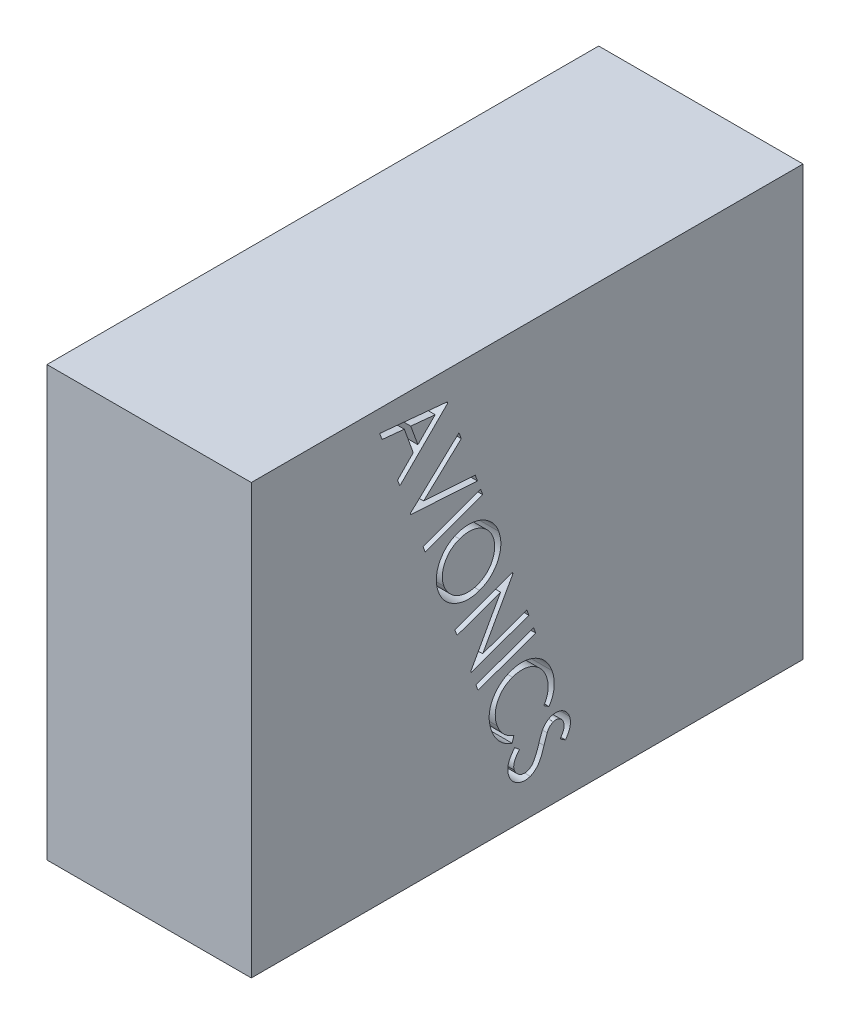
from build123d import *

# Parameters (mm, degrees)
SKETCH1_W           = 25.4
SKETCH1_H           = 68.58
BOSS_EXTRUDE1_DEPTH = 53.34
CUT_EXTRUDE1_DEPTH  = 12.7


with BuildPart() as part:
    # Sketch1 → Boss-Extrude1 (new body)
    with BuildSketch(Plane(origin=(0, 0, 0), x_dir=(1, 0, 0), z_dir=(0, 1, 0))):
        with Locations((12.7, -34.29)):
            Rectangle(SKETCH1_W, SKETCH1_H)
    extrude(amount=BOSS_EXTRUDE1_DEPTH)

    # Sketch2 → Cut-Extrude1 (cut)
    # profile 1 of 8: a face of its own
    with BuildSketch(Plane(origin=(25.4, 0, 0), x_dir=(0, 0, -1), z_dir=(1, 0, 0))):
        Polygon((-44.16917092, 49.671424019), (-50.119243036, 43.742722096), (-50.397055536, 44.512049019), (-48.447788709, 46.487265366), (-49.565144478, 49.572205269), (-52.32495217, 49.839332673), (-52.614976209, 50.637662), (-44.231755055, 49.845438442), align=None)
        Polygon((-45.720036305, 49.208912), (-48.75918294, 49.501988923), (-47.872319959, 47.053575462), align=None, mode=Mode.SUBTRACT)
    # profile 2 of 8: a face of its own
    with BuildSketch(Plane(origin=(25.4, 0, 0), x_dir=(0, 0, -1), z_dir=(1, 0, 0))):
        Polygon((-42.766043114, 45.790495402), (-42.483651287, 45.012009825), (-47.157617633, 40.640279055), (-40.75266571, 40.229666075), (-40.470273883, 39.451180498), (-48.755802729, 39.974750209), (-48.812281094, 40.130447325), align=None)
    # profile 3 of 8: a face of its own
    with BuildSketch(Plane(origin=(25.4, 0, 0), x_dir=(0, 0, -1), z_dir=(1, 0, 0))):
        Polygon((-40.079346336, 38.366271869), (-39.819851144, 37.651896869), (-46.977339125, 35.061524272), (-47.236834317, 35.775899272), align=None)
    # profile 4 of 8: a face of its own
    with BuildSketch(Plane(origin=(25.4, 0, 0), x_dir=(0, 0, -1), z_dir=(1, 0, 0))):
        with BuildLine():
            add(Edge.make_bspline(
                [(-37.829882754, 32.714863476), (-37.785267167, 32.580724937), (-37.697538369, 32.316964814), (-37.608763569, 31.915252951), (-37.561123176, 31.518007358), (-37.55242409, 31.124608635), (-37.58733616, 30.735568172), (-37.658403194, 30.350062921), (-37.772991137, 29.969957756), (-37.924818405, 29.598624354), (-38.110002692, 29.243614543), (-38.323122902, 28.911805727), (-38.568114338, 28.611093099), (-38.839561192, 28.338001257), (-39.138588589, 28.091964945), (-39.467218294, 27.877009137), (-39.822870145, 27.688109165), (-40.076186734, 27.590081998), (-40.205026985, 27.540224052)],
                knots=[0, 0, 0, 0, 1.067200589, 2.098464488, 3.10092662, 4.084942768, 5.064739798, 6.046118302, 7.040726449, 8.057691432, 9.071856908, 10.061074992, 11.031001726, 11.995706702, 12.965085102, 13.949971397, 14.957327668, 16, 16, 16, 16], degree=3))
            add(Edge.make_bspline(
                [(-40.205026985, 27.540224052), (-40.335093963, 27.497115516), (-40.591217345, 27.41222768), (-40.982366944, 27.327958075), (-41.370553718, 27.285546127), (-41.756272646, 27.279470221), (-42.139712091, 27.317761712), (-42.520925823, 27.391996525), (-42.898995188, 27.508211758), (-43.269648466, 27.661629242), (-43.625617833, 27.846759145), (-43.956021023, 28.063651435), (-44.258417921, 28.306790188), (-44.531070294, 28.578402419), (-44.775871881, 28.876847914), (-44.990908184, 29.202719403), (-45.178059724, 29.556458023), (-45.276255075, 29.807447233), (-45.326240927, 29.935212033)],
                knots=[0, 0, 0, 0, 1.044064595, 2.055935797, 3.043295084, 4.016974325, 4.991163374, 5.975538993, 6.973116273, 8.001038217, 9.029896524, 10.027209824, 11.009198109, 11.982900529, 12.955860951, 13.946696156, 14.954775961, 16, 16, 16, 16], degree=3))
            add(Edge.make_bspline(
                [(-45.326240927, 29.935212033), (-45.369906317, 30.066287097), (-45.456052335, 30.324880802), (-45.54114773, 30.719662691), (-45.586270676, 31.111362042), (-45.59031114, 31.499483506), (-45.557784786, 31.884910503), (-45.481044187, 32.266482352), (-45.368312915, 32.645863031), (-45.214045642, 33.015956312), (-45.029524666, 33.371442386), (-44.816155994, 33.702748209), (-44.572791888, 34.003306949), (-44.305489781, 34.276517743), (-44.010121805, 34.519557647), (-43.687340168, 34.731245714), (-43.340204883, 34.919236283), (-43.092205105, 35.015307967), (-42.966361119, 35.064058187)],
                knots=[0, 0, 0, 0, 1.054117405, 2.079633748, 3.076545789, 4.059373172, 5.038100599, 6.023871227, 7.025456738, 8.054835403, 9.079910253, 10.079769352, 11.057687069, 12.027307119, 12.993177383, 13.971411352, 14.970621335, 16, 16, 16, 16], degree=3))
            add(Edge.make_bspline(
                [(-42.966361119, 35.064058187), (-42.88071638, 35.093169872), (-42.710449814, 35.151045542), (-42.450638815, 35.217376557), (-42.190248228, 35.268262085), (-41.928739556, 35.302185524), (-41.666025054, 35.31767948), (-41.402492569, 35.313428579), (-41.138222606, 35.296418077), (-40.874920937, 35.25856626), (-40.614543722, 35.207978885), (-40.360823788, 35.13865117), (-40.114531537, 35.054664955), (-39.875506893, 34.955493097), (-39.645083069, 34.839387187), (-39.422804937, 34.706929643), (-39.207549744, 34.560965037), (-39.001644034, 34.399104562), (-38.807469216, 34.224116155), (-38.624728935, 34.039206602), (-38.457160682, 33.843326739), (-38.301769587, 33.638805812), (-38.16315491, 33.422006061), (-38.036190694, 33.196763372), (-37.923811972, 32.960624422), (-37.861363793, 32.797231987), (-37.829882754, 32.714863476)],
                knots=[0, 0, 0, 0, 1.036257293, 2.060137867, 3.069858606, 4.075125121, 5.079698108, 6.082645353, 7.093779231, 8.112149705, 9.12871586, 10.131544458, 11.123551062, 12.108938427, 13.094601763, 14.07757108, 15.072161775, 16.072954239, 17.07625734, 18.065793361, 19.049851535, 20.028244846, 21.006725023, 21.996106427, 22.989807995, 24, 24, 24, 24], degree=3))
        make_face()
        with BuildLine():
            add(Edge.make_bspline(
                [(-38.518308235, 32.427892322), (-38.543346222, 32.492902124), (-38.593341859, 32.62271314), (-38.684370625, 32.809767901), (-38.784489431, 32.991375905), (-38.899919749, 33.163195725), (-39.025370396, 33.329674321), (-39.164474759, 33.487471378), (-39.314265737, 33.639484146), (-39.475957104, 33.782070144), (-39.645210831, 33.915771763), (-39.821629888, 34.036297043), (-40.002144669, 34.146136696), (-40.189837533, 34.240169366), (-40.382822638, 34.32113489), (-40.580558454, 34.390161139), (-40.783824766, 34.447042743), (-40.992038286, 34.48923246), (-41.20310525, 34.518273116), (-41.415215792, 34.534038647), (-41.628412692, 34.533505918), (-41.842005807, 34.519735569), (-42.056338367, 34.492665561), (-42.270236383, 34.449098094), (-42.484973759, 34.392938325), (-42.62623273, 34.344957987), (-42.697707273, 34.320680783)],
                knots=[0, 0, 0, 0, 0.982677163, 1.962201343, 2.93300202, 3.906825105, 4.88048935, 5.872747212, 6.87297473, 7.890247217, 8.912978623, 9.914777024, 10.903599657, 11.892630825, 12.874126806, 13.855123639, 14.846367786, 15.850402376, 16.850629893, 17.851269684, 18.84932997, 19.85664556, 20.870160701, 21.895308964, 22.935063525, 24, 24, 24, 24], degree=3))
            add(Edge.make_bspline(
                [(-42.697707273, 34.320680783), (-42.800804344, 34.280342552), (-43.003993007, 34.200842027), (-43.290760379, 34.050379827), (-43.553999297, 33.875041033), (-43.797503157, 33.679546621), (-44.016311159, 33.458235894), (-44.212824545, 33.214318136), (-44.385544276, 32.946724097), (-44.535492886, 32.660692263), (-44.658001906, 32.362055457), (-44.752413007, 32.058865341), (-44.813866132, 31.753505715), (-44.843281765, 31.446558557), (-44.839584946, 31.138151821), (-44.806088892, 30.828770582), (-44.740200113, 30.517854502), (-44.67333172, 30.314742053), (-44.639341889, 30.211498091)],
                knots=[0, 0, 0, 0, 1.049760222, 2.068917917, 3.065030173, 4.046626013, 5.026285143, 6.011636567, 7.013173136, 8.04312309, 9.071352081, 10.071491644, 11.05134105, 12.021150506, 12.991488442, 13.972371827, 14.969337595, 16, 16, 16, 16], degree=3))
            add(Edge.make_bspline(
                [(-44.639341889, 30.211498091), (-44.613377207, 30.143394831), (-44.561697953, 30.007844328), (-44.466847563, 29.813308195), (-44.366110739, 29.623866627), (-44.248878096, 29.446385922), (-44.123572474, 29.275320191), (-43.986149461, 29.113809761), (-43.837295562, 28.96085496), (-43.679228689, 28.816055595), (-43.512144315, 28.682196589), (-43.338025693, 28.561635312), (-43.158445498, 28.454179227), (-42.973316875, 28.359412256), (-42.782384511, 28.276554442), (-42.584939101, 28.207671784), (-42.381659497, 28.153316609), (-42.173839334, 28.110164279), (-41.963230405, 28.081021051), (-41.751010915, 28.068157452), (-41.538436532, 28.065709152), (-41.325127549, 28.079360088), (-41.111848199, 28.109724168), (-40.897884744, 28.149960831), (-40.683821595, 28.206695376), (-40.54312054, 28.254772972), (-40.472154389, 28.279022129)],
                knots=[0, 0, 0, 0, 1.023872924, 2.037883193, 3.039537076, 4.037277385, 5.024194777, 6.018623438, 7.014927485, 8.022258237, 9.029665142, 10.021544807, 10.996575592, 11.968875045, 12.942646167, 13.919694268, 14.905055825, 15.898043433, 16.90132984, 17.890317871, 18.884386465, 19.887647383, 20.890933789, 21.910577212, 22.946146528, 24, 24, 24, 24], degree=3))
            add(Edge.make_bspline(
                [(-40.472154389, 28.279022129), (-40.402594853, 28.30562651), (-40.264772703, 28.358339238), (-40.066045919, 28.452036063), (-39.876890286, 28.556246822), (-39.695544989, 28.668422761), (-39.52667821, 28.79429326), (-39.366272243, 28.929561989), (-39.21593563, 29.07554882), (-39.075201183, 29.231583318), (-38.945405087, 29.396134211), (-38.827919385, 29.569527666), (-38.720659768, 29.748847655), (-38.627730693, 29.935989252), (-38.546234214, 30.12906361), (-38.477582861, 30.32954349), (-38.421207549, 30.537116403), (-38.377543456, 30.750282033), (-38.34470396, 30.965201026), (-38.328932957, 31.180504251), (-38.32311217, 31.393569998), (-38.334362921, 31.604721843), (-38.35905858, 31.813716969), (-38.396561854, 32.021032726), (-38.450623697, 32.226203171), (-38.495677486, 32.360456292), (-38.518308235, 32.427892322)],
                knots=[0, 0, 0, 0, 1.05060848, 2.081628613, 3.097005521, 4.0970358, 5.087874072, 6.066014638, 7.056124275, 8.042347484, 9.029119371, 10.010889608, 10.995962214, 11.975287847, 12.956716732, 13.951216084, 14.963160293, 15.989670693, 17.02029076, 18.028560541, 19.03396315, 20.026049264, 21.00923616, 22.002049458, 22.996419216, 24, 24, 24, 24], degree=3))
        make_face(mode=Mode.SUBTRACT)
    # profile 5 of 8: a face of its own
    with BuildSketch(Plane(origin=(25.4, 0, 0), x_dir=(0, 0, -1), z_dir=(1, 0, 0))):
        Polygon((-43.274546824, 24.829265138), (-36.117058843, 27.419637734), (-36.060580478, 27.263940619), (-39.817154997, 20.523171388), (-34.338753555, 22.506019946), (-34.083837689, 21.8008036), (-41.24132567, 19.210431004), (-41.299330478, 19.370707446), (-37.596181439, 26.048892542), (-43.00741942, 24.090467061), align=None)
    # profile 6 of 8: a face of its own
    with BuildSketch(Plane(origin=(25.4, 0, 0), x_dir=(0, 0, -1), z_dir=(1, 0, 0))):
        Polygon((-33.497356517, 20.177483155), (-33.237861325, 19.463108155), (-40.395349305, 16.872735559), (-40.654844498, 17.587110559), align=None)
    # profile 7 of 8: a face of its own
    with BuildSketch(Plane(origin=(25.4, 0, 0), x_dir=(0, 0, -1), z_dir=(1, 0, 0))):
        with BuildLine():
            Line((-31.577604473, 10.725233416), (-32.215657358, 11.132793512))
            add(Edge.make_bspline(
                [(-32.215657358, 11.132793512), (-32.180392559, 11.1899031), (-32.110319064, 11.303383643), (-32.017547123, 11.479492825), (-31.934928876, 11.657586422), (-31.864166895, 11.838438067), (-31.80634467, 12.022224769), (-31.759222387, 12.208280749), (-31.721798365, 12.396679195), (-31.6901104, 12.651581065), (-31.67484719, 12.974069313), (-31.705269062, 13.363767805), (-31.779231151, 13.755363539), (-31.863181307, 14.010428552), (-31.905789569, 14.139884858)],
                knots=[0, 0, 0, 0, 0.770156689, 1.530352452, 2.282860732, 3.022455832, 3.75751832, 4.492604005, 5.224435024, 5.960355296, 7.439199635, 8.920808603, 10.437179852, 12, 12, 12, 12], degree=3))
            add(Edge.make_bspline(
                [(-31.905789569, 14.139884858), (-31.932356927, 14.209966451), (-31.985234959, 14.349452534), (-32.080226072, 14.550903965), (-32.18775124, 14.743568886), (-32.305013397, 14.928416514), (-32.433504058, 15.104746457), (-32.574254102, 15.27158968), (-32.72769571, 15.428688417), (-32.890182927, 15.577588764), (-33.06036674, 15.716526496), (-33.237626481, 15.841521611), (-33.419507087, 15.953481084), (-33.606920643, 16.051325222), (-33.798558129, 16.137556655), (-33.996653138, 16.206984865), (-34.198678595, 16.265998384), (-34.405918684, 16.3095871), (-34.615908131, 16.340589333), (-34.827142903, 16.355426329), (-35.038721665, 16.356979225), (-35.251428016, 16.345009817), (-35.465670909, 16.317393872), (-35.680567665, 16.273967355), (-35.8967108, 16.218452978), (-36.038187671, 16.169046343), (-36.109611685, 16.144103608)],
                knots=[0, 0, 0, 0, 1.038340507, 2.066648967, 3.082993726, 4.094287257, 5.09845153, 6.104198958, 7.116450724, 8.139548353, 9.157090926, 10.158751694, 11.143138996, 12.114561561, 13.086802683, 14.052501663, 15.02105383, 16.00156971, 16.984794658, 17.960405069, 18.933489607, 19.915221695, 20.910508737, 21.924134845, 22.952008063, 24, 24, 24, 24], degree=3))
            add(Edge.make_bspline(
                [(-36.109611685, 16.144103608), (-36.215286936, 16.102816429), (-36.423198055, 16.021585833), (-36.716285832, 15.867564051), (-36.98532458, 15.690159823), (-37.23218592, 15.491101684), (-37.452624391, 15.266315336), (-37.651019782, 15.019126868), (-37.824908765, 14.748211783), (-37.973391386, 14.457546194), (-38.095845212, 14.154071133), (-38.184718609, 13.841891787), (-38.239406368, 13.524591937), (-38.264673082, 13.203085543), (-38.255164111, 12.87613896), (-38.210868116, 12.54475733), (-38.137225731, 12.208141), (-38.063005144, 11.986997963), (-38.025296781, 11.874644474)],
                knots=[0, 0, 0, 0, 1.040053598, 2.046256863, 3.030032179, 3.992181451, 4.949246196, 5.912097015, 6.894687067, 7.896594933, 8.901921086, 9.891744485, 10.867739637, 11.85067323, 12.845161879, 13.861692185, 14.913615597, 16, 16, 16, 16], degree=3))
            add(Edge.make_bspline(
                [(-38.025296781, 11.874644474), (-37.977652593, 11.752817147), (-37.883848366, 11.512957493), (-37.697915137, 11.179020271), (-37.483295413, 10.872370916), (-37.236705031, 10.594901718), (-36.957525026, 10.347042955), (-36.647056609, 10.129036748), (-36.307264167, 9.935006339), (-36.062068131, 9.835599599), (-35.937123704, 9.784944954)],
                knots=[0, 0, 0, 0, 1.027142456, 2.022288772, 2.995309205, 3.964055138, 4.932801071, 5.922541067, 6.941390241, 8, 8, 8, 8], degree=3))
            Line((-35.937123704, 9.784944954), (-36.161510723, 9.065990627))
            add(Edge.make_bspline(
                [(-36.161510723, 9.065990627), (-36.233608314, 9.091018013), (-36.37743053, 9.140943315), (-36.585890261, 9.231942255), (-36.789052558, 9.332320093), (-36.983846125, 9.447679949), (-37.173221907, 9.572488388), (-37.35633098, 9.708862133), (-37.530990135, 9.859053391), (-37.700666325, 10.018501075), (-37.861079516, 10.189947242), (-38.012348254, 10.371965305), (-38.154396763, 10.563893274), (-38.285144895, 10.766752157), (-38.410470042, 10.977274206), (-38.521971249, 11.200561269), (-38.626671329, 11.432504714), (-38.687564279, 11.592428417), (-38.718301588, 11.673154089)],
                knots=[0, 0, 0, 0, 0.967901867, 1.930796716, 2.883467384, 3.841133256, 4.800776904, 5.760029666, 6.735372506, 7.721697631, 8.712722229, 9.711975061, 10.722898728, 11.739884189, 12.772826926, 13.829441077, 14.904353615, 16, 16, 16, 16], degree=3))
            add(Edge.make_bspline(
                [(-38.718301588, 11.673154089), (-38.745428574, 11.750778712), (-38.798958159, 11.903955105), (-38.866621016, 12.134525525), (-38.918930702, 12.36331788), (-38.964734213, 12.588376708), (-38.994858222, 12.811767768), (-39.012812102, 13.032389229), (-39.021697933, 13.250454426), (-39.014434421, 13.465989811), (-38.998387172, 13.67855507), (-38.969235097, 13.888062302), (-38.927719308, 14.094931052), (-38.874639551, 14.299461973), (-38.807894562, 14.501240618), (-38.732965191, 14.701505747), (-38.641605633, 14.897324815), (-38.573847304, 15.025002595), (-38.539707838, 15.089331974)],
                knots=[0, 0, 0, 0, 1.116479952, 2.203145904, 3.260624569, 4.302619282, 5.320770913, 6.319132338, 7.307739823, 8.282317243, 9.245687013, 10.20129557, 11.152498069, 12.10937959, 13.068553165, 14.037333571, 15.011126978, 16, 16, 16, 16], degree=3))
            add(Edge.make_bspline(
                [(-38.539707838, 15.089331974), (-38.477008628, 15.194387569), (-38.352836664, 15.402443771), (-38.133608357, 15.691121762), (-37.890174922, 15.955637464), (-37.623348669, 16.197556593), (-37.333716413, 16.417887179), (-37.017523511, 16.610454559), (-36.679579892, 16.784040185), (-36.440274938, 16.875922866), (-36.318734281, 16.922589185)],
                knots=[0, 0, 0, 0, 0.996910789, 1.974321049, 2.949104117, 3.924151989, 4.907373373, 5.911337458, 6.939188626, 8, 8, 8, 8], degree=3))
            add(Edge.make_bspline(
                [(-36.318734281, 16.922589185), (-36.189210548, 16.965842466), (-35.934283438, 17.050973073), (-35.543864845, 17.133249955), (-35.156700427, 17.17476242), (-34.772497725, 17.176613908), (-34.391909388, 17.138034352), (-34.01416988, 17.059981505), (-33.640232551, 16.939405174), (-33.2736867, 16.781239963), (-32.920745964, 16.590533791), (-32.591563097, 16.367465015), (-32.29001581, 16.113453055), (-32.01596311, 15.830045256), (-31.769146904, 15.516934831), (-31.550242178, 15.174290455), (-31.357910335, 14.802417149), (-31.255651116, 14.538320285), (-31.203626108, 14.403959377)],
                knots=[0, 0, 0, 0, 1.028861816, 2.024993898, 3.001024751, 3.960044146, 4.916205285, 5.879939063, 6.862596217, 7.873014172, 8.885759611, 9.882696463, 10.865510842, 11.852993062, 12.849900394, 13.866112585, 14.914371621, 16, 16, 16, 16], degree=3))
            add(Edge.make_bspline(
                [(-31.203626108, 14.403959377), (-31.174643892, 14.321340995), (-31.117173332, 14.157512089), (-31.04939425, 13.908987026), (-30.995396802, 13.661854916), (-30.956191362, 13.416700797), (-30.928757554, 13.1727582), (-30.920715554, 12.930475963), (-30.925018294, 12.689445949), (-30.943225709, 12.450893652), (-30.975108493, 12.215879914), (-31.020944912, 11.985925031), (-31.080980771, 11.761931227), (-31.151621436, 11.54238422), (-31.24062251, 11.330669837), (-31.336876421, 11.121749016), (-31.450804394, 10.920194072), (-31.535196409, 10.790437666), (-31.577604473, 10.725233416)],
                knots=[0, 0, 0, 0, 1.093024825, 2.167423954, 3.214265893, 4.250468112, 5.266467754, 6.277428544, 7.275144954, 8.275588832, 9.263117452, 10.235049986, 11.201358948, 12.157757648, 13.112297293, 14.067302041, 15.028794611, 16, 16, 16, 16], degree=3))
        make_face()
    # profile 8 of 8: a face of its own
    with BuildSketch(Plane(origin=(25.4, 0, 0), x_dir=(0, 0, -1), z_dir=(1, 0, 0))):
        with BuildLine():
            Line((-35.829607395, 8.418911455), (-35.243453549, 7.941135013))
            add(Edge.make_bspline(
                [(-35.243453549, 7.941135013), (-35.317752685, 7.854334052), (-35.459821852, 7.688359845), (-35.639468566, 7.43092737), (-35.780683725, 7.180796802), (-35.883327526, 6.937362246), (-35.946875279, 6.699400051), (-35.968173142, 6.468001903), (-35.954235724, 6.242292591), (-35.910807251, 6.100684501), (-35.889138645, 6.030029244)],
                knots=[0, 0, 0, 0, 1.293664354, 2.47364674, 3.549622635, 4.541866154, 5.458928146, 6.327240164, 7.165377649, 8, 8, 8, 8], degree=3))
            add(Edge.make_bspline(
                [(-35.889138645, 6.030029244), (-35.865762732, 5.971286302), (-35.81941521, 5.854816422), (-35.722842264, 5.693958113), (-35.60889365, 5.546125478), (-35.478500009, 5.412604033), (-35.334946621, 5.296960869), (-35.181373175, 5.204434174), (-35.020006545, 5.136099881), (-34.852911347, 5.091880763), (-34.68328553, 5.072815867), (-34.516021299, 5.073508692), (-34.351477751, 5.097979715), (-34.246324168, 5.131055024), (-34.193261241, 5.14774559)],
                knots=[0, 0, 0, 0, 1.069383539, 2.120271267, 3.164885406, 4.225306547, 5.273788523, 6.278832104, 7.252037687, 8.232428784, 9.195584838, 10.135005729, 11.0588808, 12, 12, 12, 12], degree=3))
            add(Edge.make_bspline(
                [(-34.193261241, 5.14774559), (-34.134141626, 5.172094673), (-34.014951698, 5.221184393), (-33.853471207, 5.335584834), (-33.703531683, 5.476402919), (-33.619704173, 5.588977485), (-33.576578549, 5.646892225)],
                knots=[0, 0, 0, 0, 0.949320376, 1.913906671, 2.926795319, 4, 4, 4, 4], degree=3))
            add(Edge.make_bspline(
                [(-33.576578549, 5.646892225), (-33.546535175, 5.692355575), (-33.483567539, 5.787641801), (-33.395497637, 5.944460611), (-33.307074922, 6.120261961), (-33.218976589, 6.316011868), (-33.130091358, 6.531058619), (-33.044641108, 6.766671776), (-32.954675081, 7.019797713), (-32.899738147, 7.196531453), (-32.871362203, 7.287817705)],
                knots=[0, 0, 0, 0, 0.729544299, 1.529045293, 2.406639369, 3.364153382, 4.402992643, 5.521873366, 6.720001654, 8, 8, 8, 8], degree=3))
            add(Edge.make_bspline(
                [(-32.871362203, 7.287817705), (-32.8432249, 7.378501842), (-32.789338511, 7.552173099), (-32.706668384, 7.798729725), (-32.629514691, 8.021065709), (-32.554154706, 8.21689735), (-32.486910891, 8.388987949), (-32.420359466, 8.533958104), (-32.361458229, 8.655780686), (-32.317321797, 8.725029626), (-32.297419895, 8.756255205)],
                knots=[0, 0, 0, 0, 1.441891787, 2.761399838, 3.949117964, 5.01540607, 5.948087128, 6.753860569, 7.438093562, 8, 8, 8, 8], degree=3))
            add(Edge.make_bspline(
                [(-32.297419895, 8.756255205), (-32.265902839, 8.801420381), (-32.203548758, 8.890776221), (-32.101759907, 9.01643954), (-31.991015077, 9.129313754), (-31.874774251, 9.232668794), (-31.75072056, 9.323886487), (-31.620782685, 9.405876405), (-31.482566404, 9.474285672), (-31.386912137, 9.512481712), (-31.338814126, 9.531687898)],
                knots=[0, 0, 0, 0, 1.053241789, 2.083758222, 3.088541995, 4.074534213, 5.055518917, 6.030353795, 7.009599163, 8, 8, 8, 8], degree=3))
            add(Edge.make_bspline(
                [(-31.338814126, 9.531687898), (-31.26152057, 9.55681071), (-31.10916749, 9.606330206), (-30.873522836, 9.641303908), (-30.63840033, 9.649309073), (-30.40567915, 9.61982772), (-30.177663214, 9.565677048), (-29.961953156, 9.474289544), (-29.757044661, 9.35699671), (-29.568903502, 9.207499924), (-29.396627594, 9.037159607), (-29.249798649, 8.843511439), (-29.122884624, 8.633829824), (-29.062779015, 8.480995759), (-29.032359799, 8.403647032)],
                knots=[0, 0, 0, 0, 1.01997265, 2.010464839, 2.982932366, 3.968207478, 4.95009329, 5.919274448, 6.90215955, 7.909034776, 8.93109064, 9.939102706, 10.956987879, 12, 12, 12, 12], degree=3))
            add(Edge.make_bspline(
                [(-29.032359799, 8.403647032), (-29.004975757, 8.319289472), (-28.950687873, 8.152053621), (-28.912732077, 7.891075929), (-28.905810087, 7.628026909), (-28.930414901, 7.406713407), (-28.968798431, 7.226518184), (-29.01037556, 7.083579344), (-29.065901874, 6.935301574), (-29.131735028, 6.779520943), (-29.21163909, 6.618491881), (-29.303108189, 6.450037806), (-29.408951829, 6.276764834), (-29.484909625, 6.160094686), (-29.523874222, 6.10024559)],
                knots=[0, 0, 0, 0, 1.297906738, 2.57305374, 3.848636809, 5.146543547, 5.82521794, 6.547403773, 7.325990686, 8.144620154, 9.025111794, 9.959535132, 10.953288578, 12, 12, 12, 12], degree=3))
            Line((-29.523874222, 6.10024559), (-30.178717972, 6.524596552))
            add(Edge.make_bspline(
                [(-30.178717972, 6.524596552), (-30.147932646, 6.572776395), (-30.088390556, 6.66596133), (-30.006274085, 6.803565172), (-29.931977623, 6.932314829), (-29.871762884, 7.055002264), (-29.818684511, 7.16853912), (-29.776175954, 7.274450396), (-29.743152168, 7.372643848), (-29.714940168, 7.492574635), (-29.697333214, 7.637769516), (-29.69848592, 7.810751707), (-29.723970337, 7.982632071), (-29.759432946, 8.09315828), (-29.777263645, 8.148731167)],
                knots=[0, 0, 0, 0, 1.179732403, 2.281727794, 3.306651358, 4.24575345, 5.100800619, 5.892380686, 6.599596892, 7.236267248, 8.431779621, 9.607768318, 10.797179211, 12, 12, 12, 12], degree=3))
            add(Edge.make_bspline(
                [(-29.777263645, 8.148731167), (-29.805416911, 8.2170832), (-29.859690251, 8.348850972), (-29.978048265, 8.522545631), (-30.124017864, 8.6624185), (-30.292530504, 8.767199606), (-30.474137424, 8.838501495), (-30.663434384, 8.870052652), (-30.856348181, 8.859341899), (-30.979622173, 8.822448258), (-31.042684318, 8.803574917)],
                knots=[0, 0, 0, 0, 1.1122035, 2.14408512, 3.142318311, 4.138338744, 5.116958019, 6.065256594, 7.010261053, 8, 8, 8, 8], degree=3))
            add(Edge.make_bspline(
                [(-31.042684318, 8.803574917), (-31.080637228, 8.787969982), (-31.156723623, 8.756685865), (-31.265509736, 8.697462208), (-31.366379168, 8.62393594), (-31.464930307, 8.541665882), (-31.556003393, 8.439115888), (-31.645002704, 8.31788066), (-31.729376214, 8.173748033), (-31.781605573, 8.069171507), (-31.808958357, 8.014404244)],
                knots=[0, 0, 0, 0, 0.870251437, 1.744643453, 2.619235323, 3.514888855, 4.462439809, 5.520320658, 6.7013792, 8, 8, 8, 8], degree=3))
            add(Edge.make_bspline(
                [(-31.808958357, 8.014404244), (-31.817294129, 7.994635547), (-31.837388574, 7.946980578), (-31.866768233, 7.860837805), (-31.904893354, 7.750600939), (-31.949469938, 7.615334079), (-31.999305712, 7.45472477), (-32.057496363, 7.269221627), (-32.121435988, 7.058515003), (-32.165709818, 6.909790497), (-32.189042491, 6.831411455)],
                knots=[0, 0, 0, 0, 0.414165374, 0.998398533, 1.756512484, 2.666845352, 3.74821421, 5.003655967, 6.420901978, 8, 8, 8, 8], degree=3))
            add(Edge.make_bspline(
                [(-32.189042491, 6.831411455), (-32.218075954, 6.736619455), (-32.274488421, 6.552437132), (-32.364218424, 6.287624838), (-32.455309528, 6.042312339), (-32.550572772, 5.817703185), (-32.645506473, 5.611832405), (-32.743616058, 5.426544617), (-32.842042357, 5.260410057), (-32.945790198, 5.114770616), (-33.05002756, 4.983105309), (-33.159514442, 4.865041425), (-33.272173594, 4.757062302), (-33.387956431, 4.657553115), (-33.51102214, 4.573887009), (-33.634548353, 4.495138636), (-33.764906395, 4.431923855), (-33.854177385, 4.396212392), (-33.898657876, 4.378418667)],
                knots=[0, 0, 0, 0, 1.532270816, 2.977225909, 4.321116316, 5.575822149, 6.747451435, 7.823972312, 8.815307931, 9.729556703, 10.585634587, 11.409347249, 12.215873236, 12.997276105, 13.765266077, 14.51388447, 15.259522617, 16, 16, 16, 16], degree=3))
            add(Edge.make_bspline(
                [(-33.898657876, 4.378418667), (-33.963430875, 4.357322032), (-34.090955662, 4.315787072), (-34.286859107, 4.275661847), (-34.483367625, 4.257729811), (-34.6803482, 4.258696003), (-34.877881206, 4.282114301), (-35.075000228, 4.32708946), (-35.272973855, 4.391385581), (-35.468105644, 4.476438036), (-35.655615461, 4.579153985), (-35.831110427, 4.697422609), (-35.991721167, 4.829821121), (-36.135849181, 4.97812637), (-36.266838713, 5.138789132), (-36.381350933, 5.315567395), (-36.481368433, 5.506660337), (-36.534061675, 5.642262507), (-36.56077326, 5.711002802)],
                knots=[0, 0, 0, 0, 0.988329933, 1.945819487, 2.895385011, 3.848219667, 4.800109151, 5.776694813, 6.778729365, 7.817440992, 8.861992316, 9.87808361, 10.885249942, 11.877628675, 12.875434926, 13.88951083, 14.930137715, 16, 16, 16, 16], degree=3))
            add(Edge.make_bspline(
                [(-36.56077326, 5.711002802), (-36.595134941, 5.81907512), (-36.662844064, 6.032029837), (-36.705983346, 6.36303531), (-36.70128143, 6.693470517), (-36.657642549, 6.968248135), (-36.593520201, 7.187250176), (-36.533305753, 7.356841922), (-36.454900576, 7.528276973), (-36.358393129, 7.700569532), (-36.251239843, 7.878364438), (-36.124580828, 8.056500782), (-35.984422191, 8.23864233), (-35.882078808, 8.357812801), (-35.829607395, 8.418911455)],
                knots=[0, 0, 0, 0, 1.376306033, 2.711988281, 4.035702685, 5.38297678, 6.077926757, 6.807675016, 7.568828939, 8.366019015, 9.207198164, 10.09087052, 11.021190064, 12, 12, 12, 12], degree=3))
        make_face()
    extrude(amount=-CUT_EXTRUDE1_DEPTH, mode=Mode.SUBTRACT)


solid = part.part
